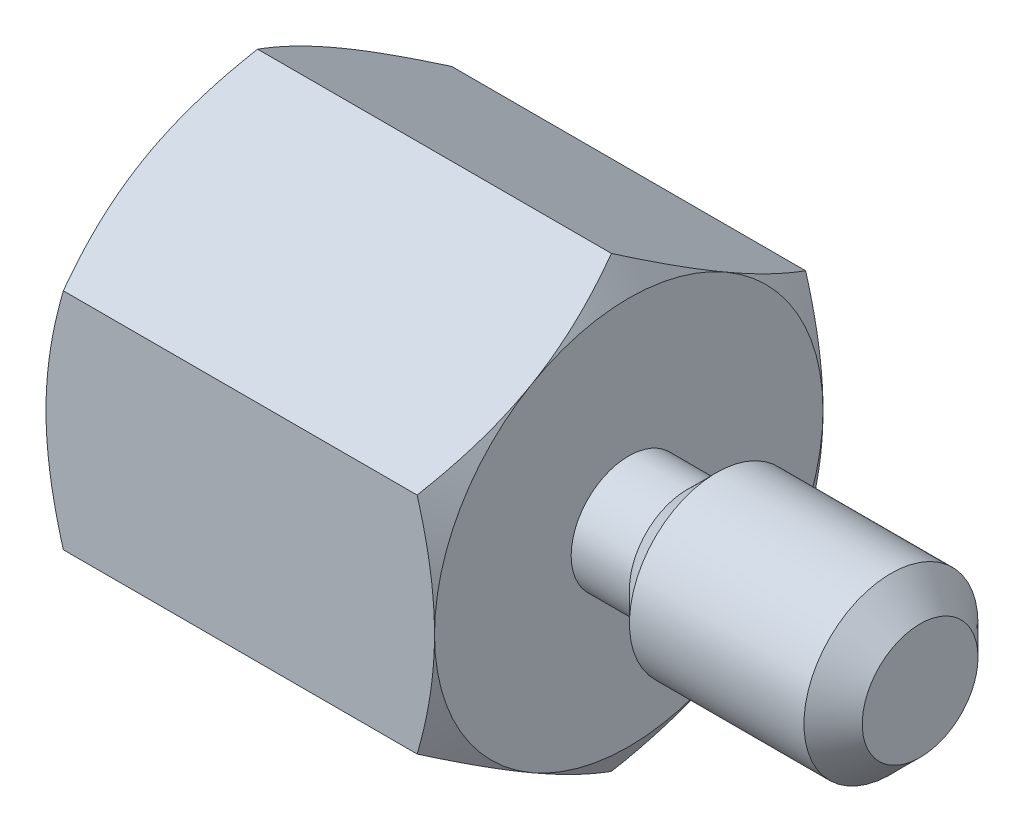
from build123d import *

# Parameters (mm, degrees)
SKETCH2_R         = 1.4224
EXTRUDE1_DEPTH    = 4.7625
CHAMFER1_SIZE     = 0.47625
EXTRUDE4_DEPTH    = 6.35
SKETCH8_OUTSIDE_W = 56.766
SKETCH8_OUTSIDE_H = 57.748
SKETCH8_OUTSIDE_R = 3.175
EXTRUDE5_DEPTH    = 13.124731526
EXTRUDE5_DRAFT    = -60
EXTRUDE7_START    = -3.175
SKETCH10_R        = 1.4224
EXTRUDE7_DEPTH    = 3.175
SKETCH9_OUTSIDE_W = 42.444
SKETCH9_OUTSIDE_H = 43.426
SKETCH9_OUTSIDE_R = 3.175
EXTRUDE6_DEPTH    = 8.990241444
EXTRUDE6_DRAFT    = -60
CHAMFER2_SIZE     = 0.15875


with BuildPart() as part:
    # Sketch2 → Extrude1 (new body)
    with BuildSketch(Plane(origin=(5.55625, 0, 0), x_dir=(0, 0, -1), z_dir=(1, 0, 0))):
        Circle(SKETCH2_R)
    extrude(amount=-EXTRUDE1_DEPTH)

    # Chamfer1
    chamfer1_edges = [part.edges().sort_by_distance(p)[0] for p in [
        (5.55625, 0, 1.4224),
    ]]
    chamfer(chamfer1_edges, length=CHAMFER1_SIZE)

    # Sketch16 → Cut-Revolve1 (revolve, cut)
    with BuildSketch(Plane.XY, mode=Mode.PRIVATE) as cut_revolve1_sk:
        Polygon((0.79375, 0.941214635), (1.74625, 0.941214635), (2.261805748, 1.456770383), (0.79375, 1.456770383), align=None)
    revolve(cut_revolve1_sk.sketch.rotate(Axis((0, 0, 0), (1, 0, 0)), 270), axis=Axis((0, 0, 0), (1, 0, 0)), mode=Mode.SUBTRACT)

    # Sketch7 → Extrude4 (add)
    with BuildSketch(Plane(origin=(0.79375, 0, 0), x_dir=(0, 0, -1), z_dir=(1, 0, 0))):
        Polygon((0, 3.666174209), (-3.175, 1.833087105), (-3.175, -1.833087105), (0, -3.666174209), (3.175, -1.833087105), (3.175, 1.833087105), align=None)
    extrude(amount=-EXTRUDE4_DEPTH)


with BuildPart() as extrude5_tool:
    # Sketch8 outside → Extrude5 (with draft: the straight prism first)
    with BuildSketch(Plane.ZY.offset(5.55625)):
        Rectangle(SKETCH8_OUTSIDE_W, SKETCH8_OUTSIDE_H)
        Circle(SKETCH8_OUTSIDE_R, mode=Mode.SUBTRACT)
    extrude(amount=-EXTRUDE5_DEPTH)
    # Extrude5: the draft: its side faces are tilted about the plane it starts from
    extrude5_sides = [extrude5_tool.faces().sort_by_distance(p)[0] for p in [
        (1.006115763, -28.874, 0),
        (1.006115763, 0, 28.383),
        (1.006115763, 28.874, 0),
        (1.006115763, 0, -28.383),
        (1.006115763, 0, -3.175),
    ]]
    draft(extrude5_sides, Plane.ZY.offset(5.55625), EXTRUDE5_DRAFT)


with BuildPart() as part_1:
    add(part.part)

    # Extrude5: cut by extrude5_tool
    add(extrude5_tool.part, mode=Mode.SUBTRACT)

    # Sketch10 → Extrude7 (cut)
    with BuildSketch(Plane.ZY.offset(5.55625).offset(EXTRUDE7_START)):
        with Locations(Location((0, 0, 0), (0, 0, 180))):
            Circle(SKETCH10_R)
    extrude(amount=EXTRUDE7_DEPTH, mode=Mode.SUBTRACT)


with BuildPart() as extrude6_tool:
    # Sketch9 outside → Extrude6 (with draft: the straight prism first)
    with BuildSketch(Plane(origin=(0.79375, 0, 0), x_dir=(0, 0, -1), z_dir=(1, 0, 0))):
        Rectangle(SKETCH9_OUTSIDE_W, SKETCH9_OUTSIDE_H)
        Circle(SKETCH9_OUTSIDE_R, mode=Mode.SUBTRACT)
    extrude(amount=-EXTRUDE6_DEPTH)
    # Extrude6: the draft: its side faces are tilted about the plane it starts from
    extrude6_sides = [extrude6_tool.faces().sort_by_distance(p)[0] for p in [
        (-3.701370722, -21.713, 0),
        (-3.701370722, 0, -21.222),
        (-3.701370722, 21.713, 0),
        (-3.701370722, 0, 21.222),
        (-3.701370722, 0, 3.175),
    ]]
    draft(extrude6_sides, Plane(origin=(0.79375, 0, 0), x_dir=(0, 0, -1), z_dir=(1, 0, 0)), EXTRUDE6_DRAFT)


with BuildPart() as part_2:
    add(part_1.part)

    # Extrude6: cut by extrude6_tool
    add(extrude6_tool.part, mode=Mode.SUBTRACT)


with BuildPart() as body_2:
    # Split1: the piece on the far side of the plane
    add(part_2.part)
    split(bisect_by=Plane(origin=(0.79375, 0, 0), x_dir=(0, 0, 1), z_dir=(1, 0, 0)), keep=Keep.BOTTOM)

    # Chamfer2
    chamfer2_edges = [body_2.edges().sort_by_distance(p)[0] for p in [
        (-5.55625, 0, 1.4224),
    ]]
    chamfer(chamfer2_edges, length=CHAMFER2_SIZE)


with BuildPart() as part_3:
    add(part_2.part)

    # Split1
    split(bisect_by=Plane(origin=(0.79375, 0, 0), x_dir=(0, 0, 1), z_dir=(1, 0, 0)), keep=Keep.TOP)


solid = Compound([body_2.part, part_3.part])
